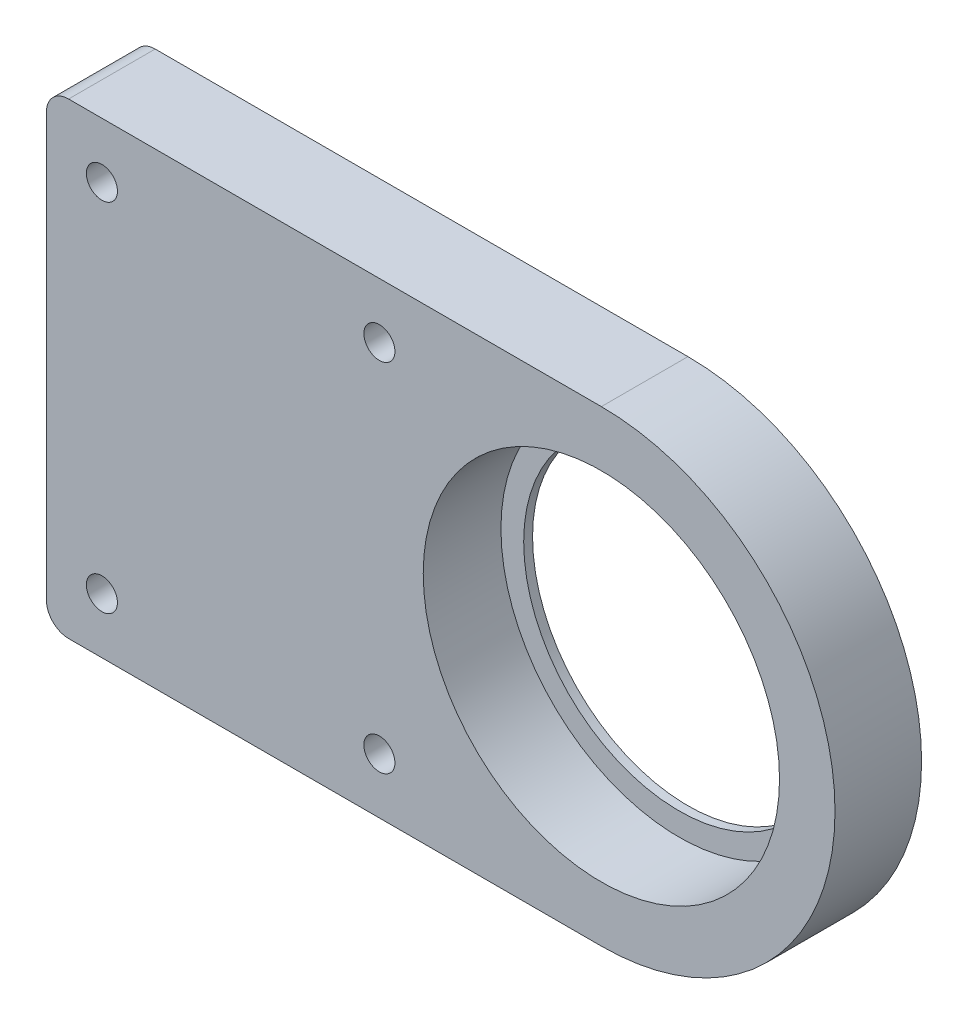
from build123d import *

# Parameters (mm, degrees)
BOSS_EXTRUDE1_DEPTH      = 3.5
BOSS_EXTRUDE1_DEPTH_BACK = 3.5
SKETCH1_R                = 16.05
BOSS_EXTRUDE2_START      = 0.8
SKETCH2_R                = 14
BOSS_EXTRUDE2_DEPTH      = 0.8
SKETCH3_R                = 1.4
CUT_EXTRUDE1_DEPTH       = 55.80823387
FILLET1_R                = 2


with BuildPart() as part:
    # Sketch1 → Boss-Extrude1 (new, two sides: drawn at the far end of the back side and taken through both)
    with BuildSketch(Plane.XY.offset(-BOSS_EXTRUDE1_DEPTH_BACK)):
        with BuildLine():
            Line((0, 21.05), (-50, 21.05))
            Line((-50, 21.05), (-50, -21.05))
            Line((-50, -21.05), (0, -21.05))
            ThreePointArc((0, -21.05), (21.05, 0), (0, 21.05))
        make_face()
        Circle(SKETCH1_R, mode=Mode.SUBTRACT)
    extrude(amount=BOSS_EXTRUDE1_DEPTH + BOSS_EXTRUDE1_DEPTH_BACK)

    # Sketch2 → Boss-Extrude2 (add)
    with BuildSketch(Plane(origin=(0, 0, -3.5), x_dir=(-1, 0, 0), z_dir=(0, 0, -1)).offset(BOSS_EXTRUDE2_START)):
        with BuildLine():
            Line((0, -21.05), (50, -21.05))
            Line((50, -21.05), (50, 21.05))
            Line((50, 21.05), (0, 21.05))
            ThreePointArc((0, 21.05), (-21.05, 0), (0, -21.05))
        make_face()
        Circle(SKETCH2_R, mode=Mode.SUBTRACT)
    extrude(amount=-BOSS_EXTRUDE2_DEPTH)

    # Sketch3 → Cut-Extrude1 (cut, through all)
    with BuildSketch(Plane(origin=(0, 0, -4.3), x_dir=(-1, 0, 0), z_dir=(0, 0, -1))):
        with Locations((20, 16.05)):
            Circle(SKETCH3_R)
        with Locations((45, 16.05)):
            Circle(SKETCH3_R)
        with Locations((45, -16.05)):
            Circle(SKETCH3_R)
        with Locations((20, -16.05)):
            Circle(SKETCH3_R)
    extrude(amount=-CUT_EXTRUDE1_DEPTH, mode=Mode.SUBTRACT)

    # Fillet1
    fillet1_edges = [part.edges().sort_by_distance(p)[0] for p in [
        (-50, -21.05, -0.4),
        (-50, 21.05, -0.4),
    ]]
    fillet(fillet1_edges, radius=FILLET1_R)


solid = part.part
